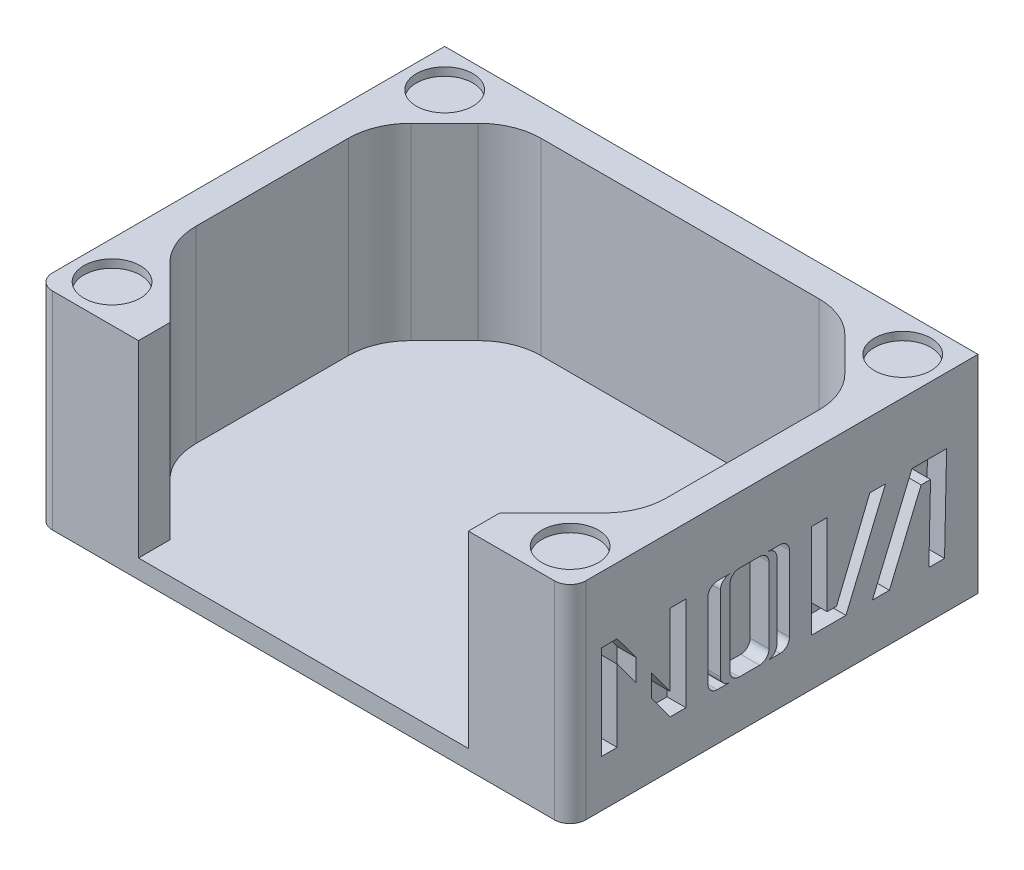
from build123d import *

# Parameters (mm, degrees)
SKETCH1_W               = 170
SKETCH1_H               = 130
BOSS_EXTRUDE1_DEPTH     = 6
BOSS_EXTRUDE2_DEPTH     = 60
SKETCH3_R               = 9
CUT_EXTRUDE1_DEPTH      = 2.6
FILLET1_R               = 20
MIRROR3_COPY_1_SKETCH_R = 9
MIRROR3_COPY_1_DEPTH    = 2.6
SKETCH5_W               = 105.147186258
SKETCH5_H               = 10
CUT_EXTRUDE2_DEPTH      = 60
CUT_EXTRUDE3_DEPTH      = 6
FILLET2_R               = 5
CUT_EXTRUDE6_DEPTH      = 6


with BuildPart() as part:
    # Sketch1 → Boss-Extrude1 (new body)
    with BuildSketch(Plane(origin=(0, 0, 0), x_dir=(1, 0, 0), z_dir=(0, 1, 0))):
        Rectangle(SKETCH1_W, SKETCH1_H)
    extrude(amount=BOSS_EXTRUDE1_DEPTH)

    # Sketch2 → Boss-Extrude2 (add)
    with BuildSketch(Plane(origin=(0, 6, 0), x_dir=(1, 0, 0), z_dir=(0, 1, 0))):
        Polygon((-75, -32.573593129), (-75, 0), (-85, 0), (-85, -65), (85, -65), (85, 0), (75, 0), (75, -32.573593129), (52.573593129, -55), (45, -55), (-45, -55), (-52.573593129, -55), align=None)
    boss_extrude2 = extrude(amount=BOSS_EXTRUDE2_DEPTH)

    # Mirror1: Boss-Extrude2 across plane
    add(boss_extrude2.mirror(Plane.XY))

    # Sketch3 → Cut-Extrude1 (cut)
    with BuildSketch(Plane(origin=(0, 66, 0), x_dir=(1, 0, 0), z_dir=(0, 1, 0))):
        with Locations(Location((-73, 53, 0), (0, 0, 270))):
            Circle(SKETCH3_R)
    cut_extrude1 = extrude(amount=-CUT_EXTRUDE1_DEPTH, mode=Mode.SUBTRACT)

    # Fillet1
    fillet1_edges = [part.edges().sort_by_distance(p)[0] for p in [
        (-75, 36, 32.573593129),
        (75, 36, 32.573593129),
        (-75, 36, -32.573593129),
        (-52.573593129, 36, -55),
        (52.573593129, 36, -55),
        (75, 36, -32.573593129),
    ]]
    fillet(fillet1_edges, radius=FILLET1_R)

    # Mirror2: Cut-Extrude1 across plane
    add(cut_extrude1.mirror(Plane(origin=(0, 0, 0), x_dir=(0, 0, 1), z_dir=(1, 0, 0))), mode=Mode.SUBTRACT)

    # Mirror3: Cut-Extrude1 across plane
    add(cut_extrude1.mirror(Plane.XY), mode=Mode.SUBTRACT)

    # Mirror3 copy 1 sketch → Mirror3 copy 1 (cut)
    with BuildSketch(Plane(origin=(0, 66, 0), x_dir=(-1, 0, 0), z_dir=(0, 1, 0))):
        with Locations(Location((-73, 53, 0), (0, 0, 270))):
            Circle(MIRROR3_COPY_1_SKETCH_R)
    extrude(amount=-MIRROR3_COPY_1_DEPTH, mode=Mode.SUBTRACT)

    # Sketch5 → Cut-Extrude2 (cut)
    with BuildSketch(Plane(origin=(0, 66, 0), x_dir=(1, 0, 0), z_dir=(0, 1, 0))):
        with Locations((0, -60)):
            Rectangle(SKETCH5_W, SKETCH5_H)
    extrude(amount=-CUT_EXTRUDE2_DEPTH, mode=Mode.SUBTRACT)

    # Sketch7 → Cut-Extrude3 (cut)
    with BuildSketch(Plane(origin=(85, 0, 0), x_dir=(0, 0, -1), z_dir=(1, 0, 0))):
        Polygon((-55, 15), (-55, 45), (-50, 45), (-44, 36.838679983), (-44, 29.838679983), (-50, 38), (-50, 15), align=None)
        Polygon((-33.090970614, 22), (-33.090970614, 45), (-28.090970614, 45), (-28.090970614, 15), (-33.090970614, 15), (-39.090970614, 23.161320017), (-39.090970614, 30.161320017), align=None)
        with BuildLine():
            Line((1.909029386, 45), (-2.090970614, 45))
            ThreePointArc((-2.090970614, 45), (0.030349729, 44.121320344), (0.909029386, 42))
            Line((0.909029386, 42), (0.909029386, 18))
            ThreePointArc((0.909029386, 18), (0.030349729, 15.878679656), (-2.090970614, 15))
            Line((-2.090970614, 15), (1.909029386, 15))
            ThreePointArc((1.909029386, 15), (4.030349729, 15.878679656), (4.909029386, 18))
            Line((4.909029386, 18), (4.909029386, 42))
            ThreePointArc((4.909029386, 42), (4.030349729, 44.121320344), (1.909029386, 45))
        make_face()
        with BuildLine():
            Line((-21.090970614, 42), (-21.090970614, 18))
            ThreePointArc((-21.090970614, 18), (-20.212290958, 15.878679656), (-18.090970614, 15))
            Line((-18.090970614, 15), (-14.090970614, 15))
            ThreePointArc((-14.090970614, 15), (-16.212290958, 15.878679656), (-17.090970614, 18))
            Line((-17.090970614, 18), (-17.090970614, 42))
            ThreePointArc((-17.090970614, 42), (-16.212290958, 44.121320344), (-14.090970614, 45))
            Line((-14.090970614, 45), (-18.090970614, 45))
            ThreePointArc((-18.090970614, 45), (-20.212290958, 44.121320344), (-21.090970614, 42))
        make_face()
        Polygon((11.909029386, 45), (11.909029386, 15), (22.909029386, 15), (35.516776739, 45), (30.516776739, 45), (19.909029386, 19), (16.909029386, 19), (16.909029386, 45), align=None)
        Polygon((31.347758846, 15), (43.9555062, 45), (55, 45), (54.340720725, 15), (49.339513512, 15), (49.867454564, 39.023554456), (46.867454564, 39.023554456), (36.771357727, 15), align=None)
        with BuildLine():
            Line((-4.624822618, 15), (-11.090970614, 15))
            ThreePointArc((-11.090970614, 15), (-13.212290958, 15.878679656), (-14.090970614, 18))
            Line((-14.090970614, 18), (-14.090970614, 42))
            ThreePointArc((-14.090970614, 42), (-13.212290958, 44.121320344), (-11.090970614, 45))
            Line((-11.090970614, 45), (-4.624822618, 45))
            ThreePointArc((-4.624822618, 45), (-2.503502275, 44.121320344), (-1.624822618, 42))
            Line((-1.624822618, 42), (-1.624822618, 18))
            ThreePointArc((-1.624822618, 18), (-2.503502275, 15.878679656), (-4.624822618, 15))
        make_face()
    extrude(amount=-CUT_EXTRUDE3_DEPTH, mode=Mode.SUBTRACT)

    # Fillet2
    fillet2_edges = [part.edges().sort_by_distance(p)[0] for p in [
        (85, 33, 65),
        (-85, 33, 65),
    ]]
    fillet(fillet2_edges, radius=FILLET2_R)

    # Sketch12 → Cut-Extrude6 (cut)
    with BuildSketch(Plane.ZY.offset(85)):
        Polygon((-39, 47), (-35, 47), (-30.482690446, 31.238340543), (-23.885743409, 47), (-19.599215517, 47), (-32.155533692, 17), (-36.491760677, 17), (-33, 25.342638252), align=None)
        Polygon((-14.599215517, 47), (-27.155533692, 17), (-23.155533692, 17), (-12.210225245, 43.791772221), (-8.210225245, 43.791772221), (-8.210225245, 17), (-4.210225245, 17), (-4.210225245, 47), align=None)
        Polygon((-37, 25.342638252), (-43, 47), (-47, 47), (-41, 25.342638252), (-44.491760677, 17), (-40.491760677, 17), align=None)
        Polygon((0.789774755, 47), (0.789774755, 17), (4.789774755, 17), (4.789774755, 30), (13.888047314, 30), (13.888047314, 34), (4.789774755, 34), (4.789774755, 43), (13.888047314, 43), (13.888047314, 47), align=None)
        Polygon((20.27200974, 47), (24.27200974, 47), (31.13600487, 36.933214608), (38, 47), (42, 47), (42, 43), (34.499696428, 32), (42, 21), (42, 17), (38, 17), (31.13600487, 27.066785392), (24.27200974, 17), (20.27200974, 17), (12.245273414, 17), (12.245273414, 21), (20.27200974, 21), (27.772313311, 32), (20.27200974, 43), align=None)
    extrude(amount=-CUT_EXTRUDE6_DEPTH, mode=Mode.SUBTRACT)


solid = part.part
